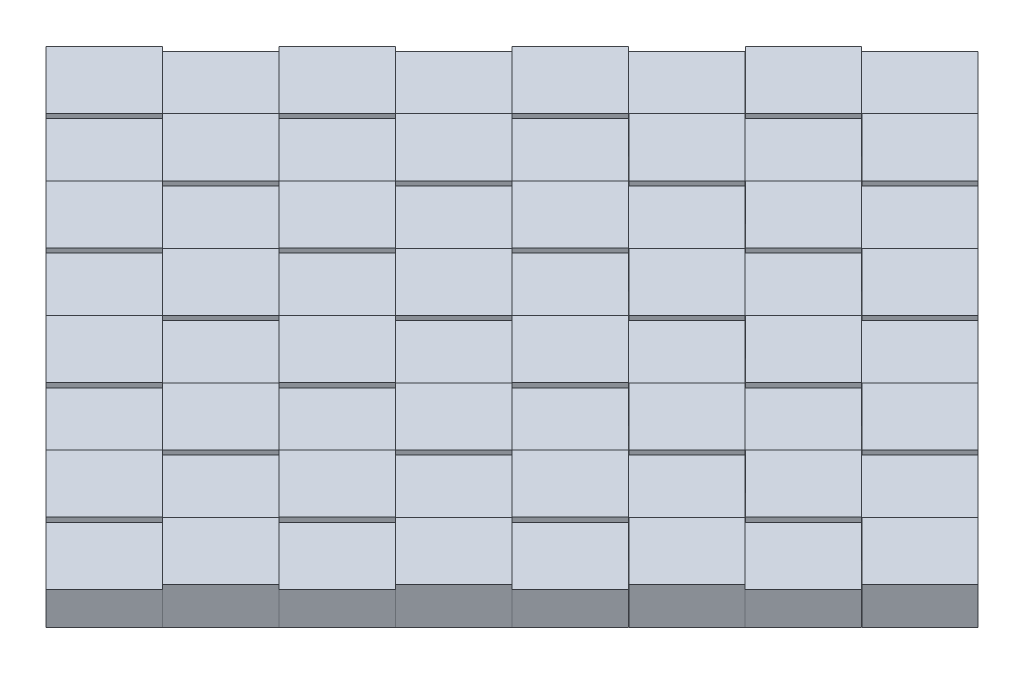
from build123d import *

# Parameters (mm, degrees)
SKETCH1_W              = 300
SKETCH1_H              = 300
BOSS_EXTRUDE1_DEPTH    = 15
SKETCH6_W              = 37.5
SKETCH6_H              = 37.5
SKETCH6_W_2            = 37.43
CUT_EXTRUDE2_DEPTH     = 100
SKETCH7_W              = 37.4
SKETCH7_H              = 37.4
BOSS_EXTRUDE2_DEPTH    = 17
BOSS_EXTRUDE2_2_DEPTH  = 17
BOSS_EXTRUDE2_3_DEPTH  = 17
BOSS_EXTRUDE2_4_DEPTH  = 17
BOSS_EXTRUDE2_5_DEPTH  = 17
BOSS_EXTRUDE2_6_DEPTH  = 17
BOSS_EXTRUDE2_7_DEPTH  = 17
BOSS_EXTRUDE2_8_DEPTH  = 17
BOSS_EXTRUDE2_9_DEPTH  = 17
BOSS_EXTRUDE2_10_DEPTH = 17
BOSS_EXTRUDE2_11_DEPTH = 17
BOSS_EXTRUDE2_12_DEPTH = 17
BOSS_EXTRUDE2_13_DEPTH = 17
BOSS_EXTRUDE2_14_DEPTH = 17
BOSS_EXTRUDE2_15_DEPTH = 17
BOSS_EXTRUDE2_16_DEPTH = 17
BOSS_EXTRUDE2_17_DEPTH = 17
BOSS_EXTRUDE2_18_DEPTH = 17
BOSS_EXTRUDE2_19_DEPTH = 17
BOSS_EXTRUDE2_20_DEPTH = 17
BOSS_EXTRUDE2_21_DEPTH = 17
BOSS_EXTRUDE2_22_DEPTH = 17
BOSS_EXTRUDE2_23_DEPTH = 17
BOSS_EXTRUDE2_24_DEPTH = 17
BOSS_EXTRUDE2_25_DEPTH = 17
BOSS_EXTRUDE2_26_DEPTH = 17
BOSS_EXTRUDE2_27_DEPTH = 17
BOSS_EXTRUDE2_28_DEPTH = 17
BOSS_EXTRUDE2_29_DEPTH = 17
BOSS_EXTRUDE2_30_DEPTH = 17
BOSS_EXTRUDE2_31_DEPTH = 17
BOSS_EXTRUDE2_32_DEPTH = 17
BODY_MOVE_COPY1_ANGLE  = 45


with BuildPart() as part:
    # Sketch1 → Boss-Extrude1 (new body)
    with BuildSketch(Plane(origin=(0, 0, 0), x_dir=(1, 0, 0), z_dir=(0, 1, 0))):
        Rectangle(SKETCH1_W, SKETCH1_H)
    extrude(amount=BOSS_EXTRUDE1_DEPTH)

    # Sketch6 → Cut-Extrude2 (cut)
    with BuildSketch(Plane(origin=(0, 15, 0), x_dir=(1, 0, 0), z_dir=(0, 1, 0))):
        with Locations((-131.25, 131.25)):
            Rectangle(SKETCH6_W, SKETCH6_H)
        with Locations((-93.74, 93.74)):
            Rectangle(SKETCH6_W, SKETCH6_H)
        with Locations((-56.23, 56.23)):
            Rectangle(SKETCH6_W, SKETCH6_H)
        with Locations((-18.72, 18.72)):
            Rectangle(SKETCH6_W, SKETCH6_H)
        with Locations((18.79, -18.79)):
            Rectangle(SKETCH6_W, SKETCH6_H)
        with Locations((56.3, -56.3)):
            Rectangle(SKETCH6_W, SKETCH6_H)
        with Locations((93.81, -93.81)):
            Rectangle(SKETCH6_W, SKETCH6_H)
        with Locations((131.32, -131.32)):
            Rectangle(SKETCH6_W, SKETCH6_H)
        with Locations((-56.23, 131.25)):
            Rectangle(SKETCH6_W, SKETCH6_H)
        with Locations((-18.72, 93.74)):
            Rectangle(SKETCH6_W, SKETCH6_H)
        with Locations((18.79, 56.23)):
            Rectangle(SKETCH6_W, SKETCH6_H)
        with Locations((56.3, 18.72)):
            Rectangle(SKETCH6_W, SKETCH6_H)
        with Locations((93.81, -18.79)):
            Rectangle(SKETCH6_W, SKETCH6_H)
        with Locations((131.285, -56.3)):
            Rectangle(SKETCH6_W_2, SKETCH6_H)
        with Locations((18.79, 131.25)):
            Rectangle(SKETCH6_W, SKETCH6_H)
        with Locations((56.3, 93.74)):
            Rectangle(SKETCH6_W, SKETCH6_H)
        with Locations((93.81, 56.23)):
            Rectangle(SKETCH6_W, SKETCH6_H)
        with Locations((131.285, 18.72)):
            Rectangle(SKETCH6_W_2, SKETCH6_H)
        with Locations((93.81, 131.25)):
            Rectangle(SKETCH6_W, SKETCH6_H)
        with Locations((131.285, 93.74)):
            Rectangle(SKETCH6_W_2, SKETCH6_H)
        with Locations((-131.25, 56.23)):
            Rectangle(SKETCH6_W, SKETCH6_H)
        with Locations((-93.74, 18.72)):
            Rectangle(SKETCH6_W, SKETCH6_H)
        with Locations((-56.23, -18.79)):
            Rectangle(SKETCH6_W, SKETCH6_H)
        with Locations((-18.72, -56.3)):
            Rectangle(SKETCH6_W, SKETCH6_H)
        with Locations((18.79, -93.81)):
            Rectangle(SKETCH6_W, SKETCH6_H)
        with Locations((56.3, -131.32)):
            Rectangle(SKETCH6_W, SKETCH6_H)
        with Locations((-131.25, -18.79)):
            Rectangle(SKETCH6_W, SKETCH6_H)
        with Locations((-93.74, -56.3)):
            Rectangle(SKETCH6_W, SKETCH6_H)
        with Locations((-56.23, -93.81)):
            Rectangle(SKETCH6_W, SKETCH6_H)
        with Locations((-18.72, -131.32)):
            Rectangle(SKETCH6_W, SKETCH6_H)
        with Locations((-93.74, -131.32)):
            Rectangle(SKETCH6_W, SKETCH6_H)
        with Locations((-131.25, -93.81)):
            Rectangle(SKETCH6_W, SKETCH6_H)
    extrude(amount=-CUT_EXTRUDE2_DEPTH, mode=Mode.SUBTRACT)


with BuildPart() as body_2:
    # Sketch7 → Boss-Extrude2 (new body)
    with BuildSketch(Plane(origin=(0, 0, 0), x_dir=(1, 0, 0), z_dir=(0, 1, 0))):
        with Locations((-131.25, 131.25)):
            Rectangle(SKETCH7_W, SKETCH7_H)
    extrude(amount=BOSS_EXTRUDE2_DEPTH)


with BuildPart() as body_3:
    # Sketch7 → Boss-Extrude2 2 (new body)
    with BuildSketch(Plane(origin=(0, 0, 0), x_dir=(1, 0, 0), z_dir=(0, 1, 0))):
        with Locations((-56.23, 131.25)):
            Rectangle(SKETCH7_W, SKETCH7_H)
    extrude(amount=BOSS_EXTRUDE2_2_DEPTH)


with BuildPart() as body_4:
    # Sketch7 → Boss-Extrude2 3 (new body)
    with BuildSketch(Plane(origin=(0, 0, 0), x_dir=(1, 0, 0), z_dir=(0, 1, 0))):
        with Locations((18.79, 131.25)):
            Rectangle(SKETCH7_W, SKETCH7_H)
    extrude(amount=BOSS_EXTRUDE2_3_DEPTH)


with BuildPart() as body_5:
    # Sketch7 → Boss-Extrude2 4 (new body)
    with BuildSketch(Plane(origin=(0, 0, 0), x_dir=(1, 0, 0), z_dir=(0, 1, 0))):
        with Locations((93.81, 131.25)):
            Rectangle(SKETCH7_W, SKETCH7_H)
    extrude(amount=BOSS_EXTRUDE2_4_DEPTH)


with BuildPart() as body_6:
    # Sketch7 → Boss-Extrude2 5 (new body)
    with BuildSketch(Plane(origin=(0, 0, 0), x_dir=(1, 0, 0), z_dir=(0, 1, 0))):
        with Locations((-93.74, 93.74)):
            Rectangle(SKETCH7_W, SKETCH7_H)
    extrude(amount=BOSS_EXTRUDE2_5_DEPTH)


with BuildPart() as body_7:
    # Sketch7 → Boss-Extrude2 6 (new body)
    with BuildSketch(Plane(origin=(0, 0, 0), x_dir=(1, 0, 0), z_dir=(0, 1, 0))):
        with Locations((-18.72, 93.74)):
            Rectangle(SKETCH7_W, SKETCH7_H)
    extrude(amount=BOSS_EXTRUDE2_6_DEPTH)


with BuildPart() as body_8:
    # Sketch7 → Boss-Extrude2 7 (new body)
    with BuildSketch(Plane(origin=(0, 0, 0), x_dir=(1, 0, 0), z_dir=(0, 1, 0))):
        with Locations((56.3, 93.74)):
            Rectangle(SKETCH7_W, SKETCH7_H)
    extrude(amount=BOSS_EXTRUDE2_7_DEPTH)


with BuildPart() as body_9:
    # Sketch7 → Boss-Extrude2 8 (new body)
    with BuildSketch(Plane(origin=(0, 0, 0), x_dir=(1, 0, 0), z_dir=(0, 1, 0))):
        with Locations((131.32, 93.74)):
            Rectangle(SKETCH7_W, SKETCH7_H)
    extrude(amount=BOSS_EXTRUDE2_8_DEPTH)


with BuildPart() as body_10:
    # Sketch7 → Boss-Extrude2 9 (new body)
    with BuildSketch(Plane(origin=(0, 0, 0), x_dir=(1, 0, 0), z_dir=(0, 1, 0))):
        with Locations((-56.23, 56.23)):
            Rectangle(SKETCH7_W, SKETCH7_H)
    extrude(amount=BOSS_EXTRUDE2_9_DEPTH)


with BuildPart() as body_11:
    # Sketch7 → Boss-Extrude2 10 (new body)
    with BuildSketch(Plane(origin=(0, 0, 0), x_dir=(1, 0, 0), z_dir=(0, 1, 0))):
        with Locations((18.79, 56.23)):
            Rectangle(SKETCH7_W, SKETCH7_H)
    extrude(amount=BOSS_EXTRUDE2_10_DEPTH)


with BuildPart() as body_12:
    # Sketch7 → Boss-Extrude2 11 (new body)
    with BuildSketch(Plane(origin=(0, 0, 0), x_dir=(1, 0, 0), z_dir=(0, 1, 0))):
        with Locations((93.81, 56.23)):
            Rectangle(SKETCH7_W, SKETCH7_H)
    extrude(amount=BOSS_EXTRUDE2_11_DEPTH)


with BuildPart() as body_13:
    # Sketch7 → Boss-Extrude2 12 (new body)
    with BuildSketch(Plane(origin=(0, 0, 0), x_dir=(1, 0, 0), z_dir=(0, 1, 0))):
        with Locations((-93.74, 18.72)):
            Rectangle(SKETCH7_W, SKETCH7_H)
    extrude(amount=BOSS_EXTRUDE2_12_DEPTH)


with BuildPart() as body_14:
    # Sketch7 → Boss-Extrude2 13 (new body)
    with BuildSketch(Plane(origin=(0, 0, 0), x_dir=(1, 0, 0), z_dir=(0, 1, 0))):
        with Locations((-18.72, 18.72)):
            Rectangle(SKETCH7_W, SKETCH7_H)
    extrude(amount=BOSS_EXTRUDE2_13_DEPTH)


with BuildPart() as body_15:
    # Sketch7 → Boss-Extrude2 14 (new body)
    with BuildSketch(Plane(origin=(0, 0, 0), x_dir=(1, 0, 0), z_dir=(0, 1, 0))):
        with Locations((56.3, 18.72)):
            Rectangle(SKETCH7_W, SKETCH7_H)
    extrude(amount=BOSS_EXTRUDE2_14_DEPTH)


with BuildPart() as body_16:
    # Sketch7 → Boss-Extrude2 15 (new body)
    with BuildSketch(Plane(origin=(0, 0, 0), x_dir=(1, 0, 0), z_dir=(0, 1, 0))):
        with Locations((131.32, 18.72)):
            Rectangle(SKETCH7_W, SKETCH7_H)
    extrude(amount=BOSS_EXTRUDE2_15_DEPTH)


with BuildPart() as body_17:
    # Sketch7 → Boss-Extrude2 16 (new body)
    with BuildSketch(Plane(origin=(0, 0, 0), x_dir=(1, 0, 0), z_dir=(0, 1, 0))):
        with Locations((-56.23, -18.79)):
            Rectangle(SKETCH7_W, SKETCH7_H)
    extrude(amount=BOSS_EXTRUDE2_16_DEPTH)


with BuildPart() as body_18:
    # Sketch7 → Boss-Extrude2 17 (new body)
    with BuildSketch(Plane(origin=(0, 0, 0), x_dir=(1, 0, 0), z_dir=(0, 1, 0))):
        with Locations((18.79, -18.79)):
            Rectangle(SKETCH7_W, SKETCH7_H)
    extrude(amount=BOSS_EXTRUDE2_17_DEPTH)


with BuildPart() as body_19:
    # Sketch7 → Boss-Extrude2 18 (new body)
    with BuildSketch(Plane(origin=(0, 0, 0), x_dir=(1, 0, 0), z_dir=(0, 1, 0))):
        with Locations((93.81, -18.79)):
            Rectangle(SKETCH7_W, SKETCH7_H)
    extrude(amount=BOSS_EXTRUDE2_18_DEPTH)


with BuildPart() as body_20:
    # Sketch7 → Boss-Extrude2 19 (new body)
    with BuildSketch(Plane(origin=(0, 0, 0), x_dir=(1, 0, 0), z_dir=(0, 1, 0))):
        with Locations((-93.74, -56.3)):
            Rectangle(SKETCH7_W, SKETCH7_H)
    extrude(amount=BOSS_EXTRUDE2_19_DEPTH)


with BuildPart() as body_21:
    # Sketch7 → Boss-Extrude2 20 (new body)
    with BuildSketch(Plane(origin=(0, 0, 0), x_dir=(1, 0, 0), z_dir=(0, 1, 0))):
        with Locations((-18.72, -56.3)):
            Rectangle(SKETCH7_W, SKETCH7_H)
    extrude(amount=BOSS_EXTRUDE2_20_DEPTH)


with BuildPart() as body_22:
    # Sketch7 → Boss-Extrude2 21 (new body)
    with BuildSketch(Plane(origin=(0, 0, 0), x_dir=(1, 0, 0), z_dir=(0, 1, 0))):
        with Locations((56.3, -56.3)):
            Rectangle(SKETCH7_W, SKETCH7_H)
    extrude(amount=BOSS_EXTRUDE2_21_DEPTH)


with BuildPart() as body_23:
    # Sketch7 → Boss-Extrude2 22 (new body)
    with BuildSketch(Plane(origin=(0, 0, 0), x_dir=(1, 0, 0), z_dir=(0, 1, 0))):
        with Locations((131.32, -56.3)):
            Rectangle(SKETCH7_W, SKETCH7_H)
    extrude(amount=BOSS_EXTRUDE2_22_DEPTH)


with BuildPart() as body_24:
    # Sketch7 → Boss-Extrude2 23 (new body)
    with BuildSketch(Plane(origin=(0, 0, 0), x_dir=(1, 0, 0), z_dir=(0, 1, 0))):
        with Locations((-56.23, -93.81)):
            Rectangle(SKETCH7_W, SKETCH7_H)
    extrude(amount=BOSS_EXTRUDE2_23_DEPTH)


with BuildPart() as body_25:
    # Sketch7 → Boss-Extrude2 24 (new body)
    with BuildSketch(Plane(origin=(0, 0, 0), x_dir=(1, 0, 0), z_dir=(0, 1, 0))):
        with Locations((18.79, -93.81)):
            Rectangle(SKETCH7_W, SKETCH7_H)
    extrude(amount=BOSS_EXTRUDE2_24_DEPTH)


with BuildPart() as body_26:
    # Sketch7 → Boss-Extrude2 25 (new body)
    with BuildSketch(Plane(origin=(0, 0, 0), x_dir=(1, 0, 0), z_dir=(0, 1, 0))):
        with Locations((93.81, -93.81)):
            Rectangle(SKETCH7_W, SKETCH7_H)
    extrude(amount=BOSS_EXTRUDE2_25_DEPTH)


with BuildPart() as body_27:
    # Sketch7 → Boss-Extrude2 26 (new body)
    with BuildSketch(Plane(origin=(0, 0, 0), x_dir=(1, 0, 0), z_dir=(0, 1, 0))):
        with Locations((-93.74, -131.32)):
            Rectangle(SKETCH7_W, SKETCH7_H)
    extrude(amount=BOSS_EXTRUDE2_26_DEPTH)


with BuildPart() as body_28:
    # Sketch7 → Boss-Extrude2 27 (new body)
    with BuildSketch(Plane(origin=(0, 0, 0), x_dir=(1, 0, 0), z_dir=(0, 1, 0))):
        with Locations((-18.72, -131.32)):
            Rectangle(SKETCH7_W, SKETCH7_H)
    extrude(amount=BOSS_EXTRUDE2_27_DEPTH)


with BuildPart() as body_29:
    # Sketch7 → Boss-Extrude2 28 (new body)
    with BuildSketch(Plane(origin=(0, 0, 0), x_dir=(1, 0, 0), z_dir=(0, 1, 0))):
        with Locations((56.3, -131.32)):
            Rectangle(SKETCH7_W, SKETCH7_H)
    extrude(amount=BOSS_EXTRUDE2_28_DEPTH)


with BuildPart() as body_30:
    # Sketch7 → Boss-Extrude2 29 (new body)
    with BuildSketch(Plane(origin=(0, 0, 0), x_dir=(1, 0, 0), z_dir=(0, 1, 0))):
        with Locations((131.32, -131.32)):
            Rectangle(SKETCH7_W, SKETCH7_H)
    extrude(amount=BOSS_EXTRUDE2_29_DEPTH)


with BuildPart() as body_31:
    # Sketch7 → Boss-Extrude2 30 (new body)
    with BuildSketch(Plane(origin=(0, 0, 0), x_dir=(1, 0, 0), z_dir=(0, 1, 0))):
        with Locations((-131.25, 56.23)):
            Rectangle(SKETCH7_W, SKETCH7_H)
    extrude(amount=BOSS_EXTRUDE2_30_DEPTH)


with BuildPart() as body_32:
    # Sketch7 → Boss-Extrude2 31 (new body)
    with BuildSketch(Plane(origin=(0, 0, 0), x_dir=(1, 0, 0), z_dir=(0, 1, 0))):
        with Locations((-131.25, -18.79)):
            Rectangle(SKETCH7_W, SKETCH7_H)
    extrude(amount=BOSS_EXTRUDE2_31_DEPTH)


with BuildPart() as body_33:
    # Sketch7 → Boss-Extrude2 32 (new body)
    with BuildSketch(Plane(origin=(0, 0, 0), x_dir=(1, 0, 0), z_dir=(0, 1, 0))):
        with Locations((-131.25, -93.81)):
            Rectangle(SKETCH7_W, SKETCH7_H)
    extrude(amount=BOSS_EXTRUDE2_32_DEPTH)


with BuildPart() as body_2_1:
    # Body-Move/Copy1: moved
    add(body_2.part.rotate(Axis((0.033939394, 0, 0.033939394), (0, 1, 0)), BODY_MOVE_COPY1_ANGLE))


with BuildPart() as body_30_1:
    # Body-Move/Copy1: moved
    add(body_30.part.rotate(Axis((0.033939394, 0, 0.033939394), (0, 1, 0)), BODY_MOVE_COPY1_ANGLE))


with BuildPart() as part_1:
    # Body-Move/Copy1: moved
    add(part.part.rotate(Axis((0.033939394, 0, 0.033939394), (0, 1, 0)), BODY_MOVE_COPY1_ANGLE))


with BuildPart() as body_29_1:
    # Body-Move/Copy1: moved
    add(body_29.part.rotate(Axis((0.033939394, 0, 0.033939394), (0, 1, 0)), BODY_MOVE_COPY1_ANGLE))


with BuildPart() as body_26_1:
    # Body-Move/Copy1: moved
    add(body_26.part.rotate(Axis((0.033939394, 0, 0.033939394), (0, 1, 0)), BODY_MOVE_COPY1_ANGLE))


with BuildPart() as body_23_1:
    # Body-Move/Copy1: moved
    add(body_23.part.rotate(Axis((0.033939394, 0, 0.033939394), (0, 1, 0)), BODY_MOVE_COPY1_ANGLE))


with BuildPart() as body_16_1:
    # Body-Move/Copy1: moved
    add(body_16.part.rotate(Axis((0.033939394, 0, 0.033939394), (0, 1, 0)), BODY_MOVE_COPY1_ANGLE))


with BuildPart() as body_19_1:
    # Body-Move/Copy1: moved
    add(body_19.part.rotate(Axis((0.033939394, 0, 0.033939394), (0, 1, 0)), BODY_MOVE_COPY1_ANGLE))


with BuildPart() as body_22_1:
    # Body-Move/Copy1: moved
    add(body_22.part.rotate(Axis((0.033939394, 0, 0.033939394), (0, 1, 0)), BODY_MOVE_COPY1_ANGLE))


with BuildPart() as body_25_1:
    # Body-Move/Copy1: moved
    add(body_25.part.rotate(Axis((0.033939394, 0, 0.033939394), (0, 1, 0)), BODY_MOVE_COPY1_ANGLE))


with BuildPart() as body_28_1:
    # Body-Move/Copy1: moved
    add(body_28.part.rotate(Axis((0.033939394, 0, 0.033939394), (0, 1, 0)), BODY_MOVE_COPY1_ANGLE))


with BuildPart() as body_27_1:
    # Body-Move/Copy1: moved
    add(body_27.part.rotate(Axis((0.033939394, 0, 0.033939394), (0, 1, 0)), BODY_MOVE_COPY1_ANGLE))


with BuildPart() as body_24_1:
    # Body-Move/Copy1: moved
    add(body_24.part.rotate(Axis((0.033939394, 0, 0.033939394), (0, 1, 0)), BODY_MOVE_COPY1_ANGLE))


with BuildPart() as body_21_1:
    # Body-Move/Copy1: moved
    add(body_21.part.rotate(Axis((0.033939394, 0, 0.033939394), (0, 1, 0)), BODY_MOVE_COPY1_ANGLE))


with BuildPart() as body_18_1:
    # Body-Move/Copy1: moved
    add(body_18.part.rotate(Axis((0.033939394, 0, 0.033939394), (0, 1, 0)), BODY_MOVE_COPY1_ANGLE))


with BuildPart() as body_15_1:
    # Body-Move/Copy1: moved
    add(body_15.part.rotate(Axis((0.033939394, 0, 0.033939394), (0, 1, 0)), BODY_MOVE_COPY1_ANGLE))


with BuildPart() as body_12_1:
    # Body-Move/Copy1: moved
    add(body_12.part.rotate(Axis((0.033939394, 0, 0.033939394), (0, 1, 0)), BODY_MOVE_COPY1_ANGLE))


with BuildPart() as body_9_1:
    # Body-Move/Copy1: moved
    add(body_9.part.rotate(Axis((0.033939394, 0, 0.033939394), (0, 1, 0)), BODY_MOVE_COPY1_ANGLE))


with BuildPart() as body_5_1:
    # Body-Move/Copy1: moved
    add(body_5.part.rotate(Axis((0.033939394, 0, 0.033939394), (0, 1, 0)), BODY_MOVE_COPY1_ANGLE))


with BuildPart() as body_8_1:
    # Body-Move/Copy1: moved
    add(body_8.part.rotate(Axis((0.033939394, 0, 0.033939394), (0, 1, 0)), BODY_MOVE_COPY1_ANGLE))


with BuildPart() as body_11_1:
    # Body-Move/Copy1: moved
    add(body_11.part.rotate(Axis((0.033939394, 0, 0.033939394), (0, 1, 0)), BODY_MOVE_COPY1_ANGLE))


with BuildPart() as body_14_1:
    # Body-Move/Copy1: moved
    add(body_14.part.rotate(Axis((0.033939394, 0, 0.033939394), (0, 1, 0)), BODY_MOVE_COPY1_ANGLE))


with BuildPart() as body_17_1:
    # Body-Move/Copy1: moved
    add(body_17.part.rotate(Axis((0.033939394, 0, 0.033939394), (0, 1, 0)), BODY_MOVE_COPY1_ANGLE))


with BuildPart() as body_20_1:
    # Body-Move/Copy1: moved
    add(body_20.part.rotate(Axis((0.033939394, 0, 0.033939394), (0, 1, 0)), BODY_MOVE_COPY1_ANGLE))


with BuildPart() as body_33_1:
    # Body-Move/Copy1: moved
    add(body_33.part.rotate(Axis((0.033939394, 0, 0.033939394), (0, 1, 0)), BODY_MOVE_COPY1_ANGLE))


with BuildPart() as body_32_1:
    # Body-Move/Copy1: moved
    add(body_32.part.rotate(Axis((0.033939394, 0, 0.033939394), (0, 1, 0)), BODY_MOVE_COPY1_ANGLE))


with BuildPart() as body_13_1:
    # Body-Move/Copy1: moved
    add(body_13.part.rotate(Axis((0.033939394, 0, 0.033939394), (0, 1, 0)), BODY_MOVE_COPY1_ANGLE))


with BuildPart() as body_10_1:
    # Body-Move/Copy1: moved
    add(body_10.part.rotate(Axis((0.033939394, 0, 0.033939394), (0, 1, 0)), BODY_MOVE_COPY1_ANGLE))


with BuildPart() as body_7_1:
    # Body-Move/Copy1: moved
    add(body_7.part.rotate(Axis((0.033939394, 0, 0.033939394), (0, 1, 0)), BODY_MOVE_COPY1_ANGLE))


with BuildPart() as body_4_1:
    # Body-Move/Copy1: moved
    add(body_4.part.rotate(Axis((0.033939394, 0, 0.033939394), (0, 1, 0)), BODY_MOVE_COPY1_ANGLE))


with BuildPart() as body_3_1:
    # Body-Move/Copy1: moved
    add(body_3.part.rotate(Axis((0.033939394, 0, 0.033939394), (0, 1, 0)), BODY_MOVE_COPY1_ANGLE))


with BuildPart() as body_6_1:
    # Body-Move/Copy1: moved
    add(body_6.part.rotate(Axis((0.033939394, 0, 0.033939394), (0, 1, 0)), BODY_MOVE_COPY1_ANGLE))


with BuildPart() as body_31_1:
    # Body-Move/Copy1: moved
    add(body_31.part.rotate(Axis((0.033939394, 0, 0.033939394), (0, 1, 0)), BODY_MOVE_COPY1_ANGLE))


solid = Compound([body_2_1.part, body_30_1.part, part_1.part, body_29_1.part, body_26_1.part, body_23_1.part, body_16_1.part, body_19_1.part, body_22_1.part, body_25_1.part, body_28_1.part, body_27_1.part, body_24_1.part, body_21_1.part, body_18_1.part, body_15_1.part, body_12_1.part, body_9_1.part, body_5_1.part, body_8_1.part, body_11_1.part, body_14_1.part, body_17_1.part, body_20_1.part, body_33_1.part, body_32_1.part, body_13_1.part, body_10_1.part, body_7_1.part, body_4_1.part, body_3_1.part, body_6_1.part, body_31_1.part])
